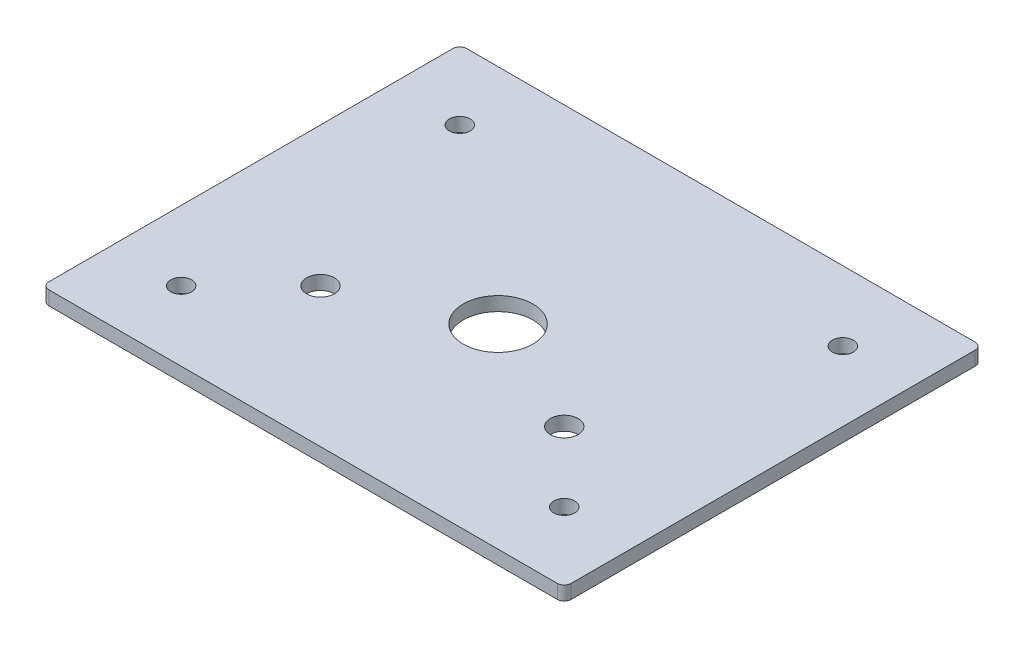
from build123d import *

# Parameters (mm, degrees)
SKETCH2_W           = 75
SKETCH2_H           = 60
BOSS_EXTRUDE1_DEPTH = 2
SKETCH4_R           = 1.5
SKETCH4_R_2         = 2
CUT_EXTRUDE2_DEPTH  = 2
SKETCH5_R           = 5
CUT_EXTRUDE3_DEPTH  = 40
FILLET1_R           = 1


with BuildPart() as part:
    # Sketch2 → Boss-Extrude1 (new body)
    with BuildSketch(Plane(origin=(0, 0, 0), x_dir=(1, 0, 0), z_dir=(0, 1, 0))):
        with Locations((37.5, 30)):
            Rectangle(SKETCH2_W, SKETCH2_H)
    extrude(amount=BOSS_EXTRUDE1_DEPTH)

    # Sketch4 → Cut-Extrude2 (cut)
    with BuildSketch(Plane(origin=(0, 2, 0), x_dir=(1, 0, 0), z_dir=(0, 1, 0))):
        with Locations(Location((10, 10, 0), (0, 0, 270))):
            Circle(SKETCH4_R)
        with Locations(Location((65, 10, 0), (0, 0, 270))):
            Circle(SKETCH4_R)
        with Locations(Location((20, 20, 0), (0, 0, 270))):
            Circle(SKETCH4_R_2)
        with Locations(Location((55, 20, 0), (0, 0, 270))):
            Circle(SKETCH4_R_2)
        with Locations(Location((10, 50, 0), (0, 0, 270))):
            Circle(SKETCH4_R)
        with Locations(Location((65, 50, 0), (0, 0, 270))):
            Circle(SKETCH4_R)
    extrude(amount=-CUT_EXTRUDE2_DEPTH, mode=Mode.SUBTRACT)

    # Sketch5 → Cut-Extrude3 (cut)
    with BuildSketch(Plane(origin=(0, 2, 0), x_dir=(1, 0, 0), z_dir=(0, 1, 0))):
        with Locations(Location((37.5, 28, 0), (0, 0, 270))):
            Circle(SKETCH5_R)
    extrude(amount=-CUT_EXTRUDE3_DEPTH, mode=Mode.SUBTRACT)

    # Fillet1
    fillet1_edges = [part.edges().sort_by_distance(p)[0] for p in [
        (0, 1, -60),
        (75, 1, -60),
        (75, 1, 0),
        (0, 1, 0),
    ]]
    fillet(fillet1_edges, radius=FILLET1_R)


solid = part.part
